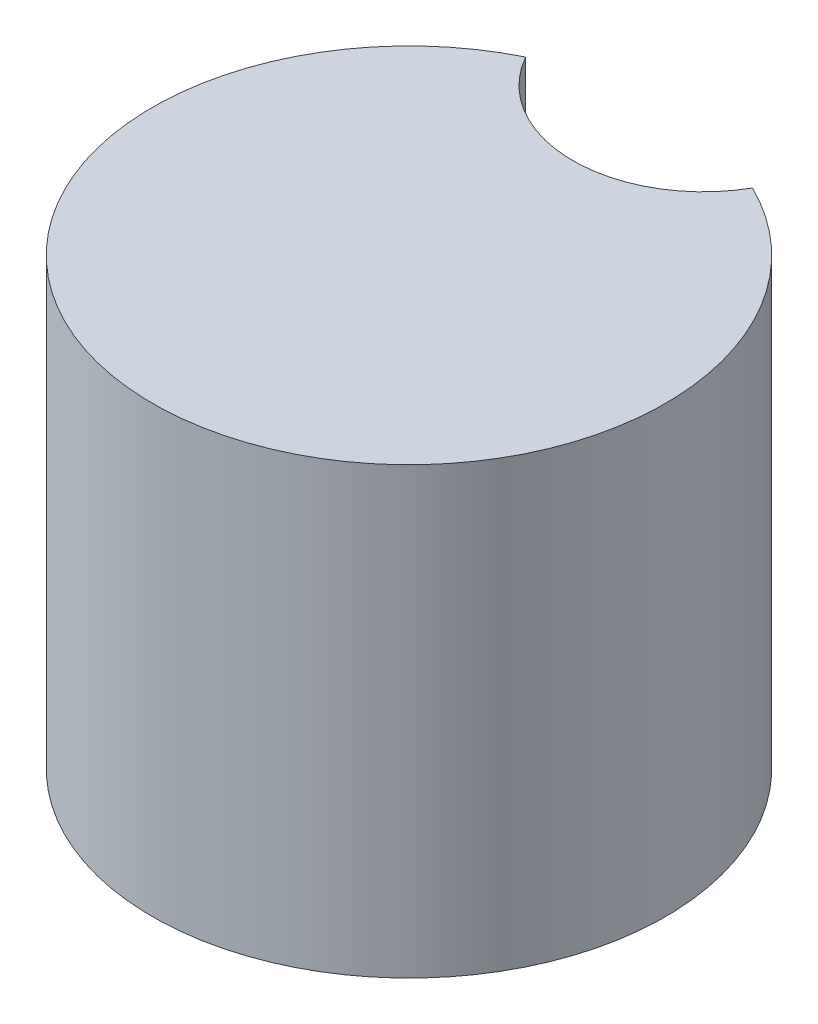
from build123d import *

# Parameters (mm, degrees)
SKETCH1_R           = 75
BOSS_EXTRUDE1_DEPTH = 130
SKETCH2_R           = 38.1
CUT_EXTRUDE1_DEPTH  = 168.779617356


with BuildPart() as part:
    # Sketch1 → Boss-Extrude1 (new body)
    with BuildSketch(Plane(origin=(0, 0, 0), x_dir=(1, 0, 0), z_dir=(0, 1, 0))):
        with Locations(Location((0, 0, 0), (0, 0, 270))):
            Circle(SKETCH1_R)
    extrude(amount=BOSS_EXTRUDE1_DEPTH)

    # Sketch2 → Cut-Extrude1 (cut, through all)
    with BuildSketch(Plane(origin=(0, 130, 0), x_dir=(1, 0, 0), z_dir=(0, 1, 0))):
        with Locations((0, 86.032265908)):
            Circle(SKETCH2_R)
    extrude(amount=-CUT_EXTRUDE1_DEPTH, mode=Mode.SUBTRACT)


solid = part.part
